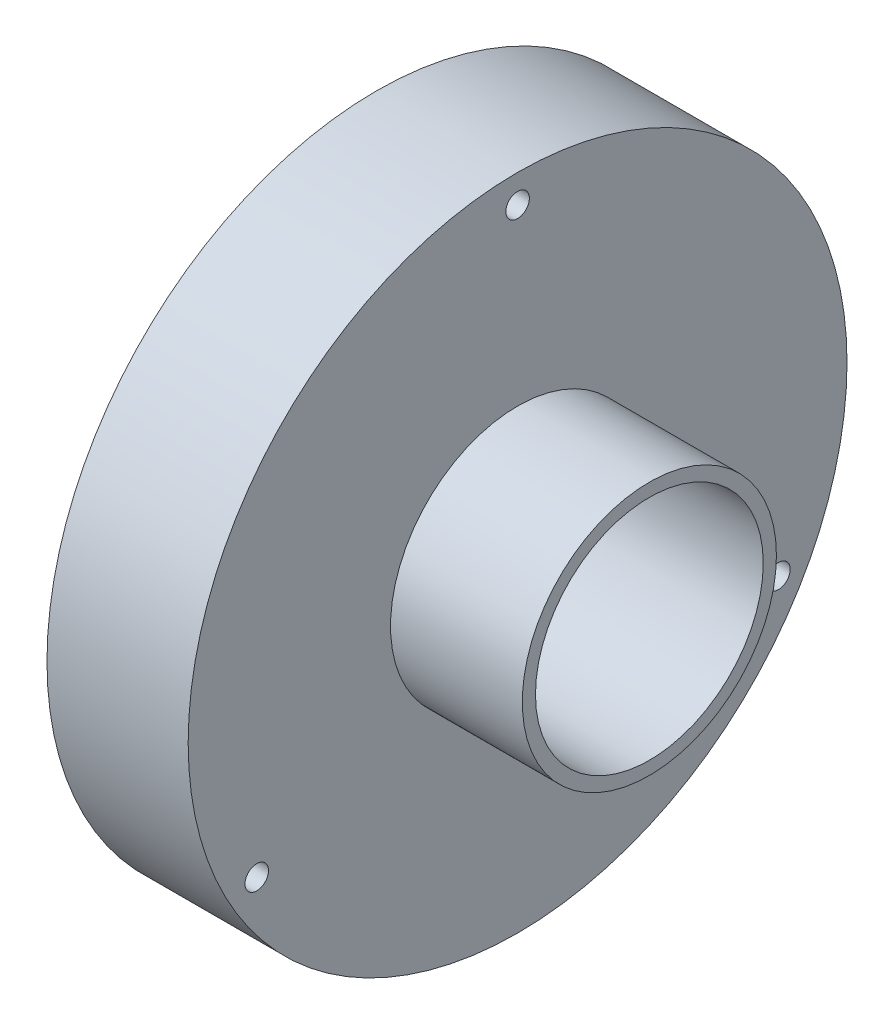
from build123d import *

# Parameters (mm, degrees)
BASPROSKE_W         = 5
BASPROSKE_H         = 4.25
TOOTHCUT_DEPTH      = 26.248762346
TEETHCUTS_COUNT     = 55
TEETHCUTS_ANGLE     = 353.454545455
BOSS_EXTRUDE1_START = 2.5
SKETCH1_R           = 17.5
SKETCH1_R_2         = 5.25
BOSS_EXTRUDE1_DEPTH = 2.5
SKETCH2_R           = 7.75
SKETCH2_R_2         = 5.25
BOSS_EXTRUDE2_DEPTH = 2.5
SKETCH3_R           = 6.05
CUT_EXTRUDE1_DEPTH  = 3.5
M1_6_TAPPED_HOLE1_D = 1.25
CIRPATTERN1_COUNT   = 3
SKETCH7_R           = 6.75
BOSS_EXTRUDE3_DEPTH = 7
SKETCH8_R           = 6.05
CUT_EXTRUDE2_DEPTH  = 7


with BuildPart() as part:
    # BasProSke → Base-Revolve (revolve)
    with BuildSketch(Plane(origin=(0, 0, 0), x_dir=(1, 0, 0), z_dir=(0, 1, 0)), mode=Mode.PRIVATE) as base_revolve_sk:
        with Locations((2.5, 15.375)):
            Rectangle(BASPROSKE_W, BASPROSKE_H)
    revolve(base_revolve_sk.sketch.rotate(Axis((-10, 0, 0), (1, 0, 0)), 180), axis=Axis((-10, 0, 0), (1, 0, 0)))

    # TooCutSke → ToothCut (cut, through all)
    with BuildSketch(Plane(origin=(0, 0, 0), x_dir=(0, 0, -1), z_dir=(1, 0, 0))):
        with BuildLine():
            ThreePointArc((0.61765291, 13.210168434), (0.417066145, 13.802967889), (0.163405078, 14.375071297))
            ThreePointArc((0.163405078, 14.375071297), (0, 14.376), (-0.163405078, 14.375071297))
            ThreePointArc((-0.163405078, 14.375071297), (-0.417066145, 13.802967889), (-0.61765291, 13.210168434))
            ThreePointArc((-0.61765291, 13.210168434), (0, 13.2246), (0.61765291, 13.210168434))
        make_face()
    toothcut = extrude(amount=TOOTHCUT_DEPTH, mode=Mode.SUBTRACT)

    # TeethCuts: ToothCut ×55 about axis
    teethcuts_axis = Axis((-10, 0, 0), (1, 0, 0))
    for i in range(1, TEETHCUTS_COUNT):
        add(toothcut.rotate(teethcuts_axis, i * TEETHCUTS_ANGLE / (TEETHCUTS_COUNT - 1)), mode=Mode.SUBTRACT)

    # Sketch1 → Boss-Extrude1 (add)
    with BuildSketch(Plane(origin=(5, 0, 0), x_dir=(0, 0, -1), z_dir=(1, 0, 0)).offset(BOSS_EXTRUDE1_START)):
        with Locations(Location((0, 0, 0), (0, 0, 180))):
            Circle(SKETCH1_R)
        Circle(SKETCH1_R_2, mode=Mode.SUBTRACT)
    extrude(amount=-BOSS_EXTRUDE1_DEPTH)

    # Sketch2 → Boss-Extrude2 (add)
    with BuildSketch(Plane.ZY.offset(-5)):
        with Locations(Location((0, 0, 0), (0, 0, 180))):
            Circle(SKETCH2_R)
        Circle(SKETCH2_R_2, mode=Mode.SUBTRACT)
    extrude(amount=BOSS_EXTRUDE2_DEPTH)

    # Sketch3 → Cut-Extrude1 (cut)
    with BuildSketch(Plane(origin=(7.5, 0, 0), x_dir=(0, 0, -1), z_dir=(1, 0, 0))):
        Circle(SKETCH3_R)
    extrude(amount=-CUT_EXTRUDE1_DEPTH, mode=Mode.SUBTRACT)

    # M1.6 Tapped Hole1 (through all)
    with Locations(Plane(origin=(7.5, 0, 0), x_dir=(0, 0, -1), z_dir=(1, 0, 0))):
        with Locations((0, 16)):
            m1_6_tapped_hole1 = Hole(M1_6_TAPPED_HOLE1_D / 2)

    # CirPattern1: M1.6 Tapped Hole1 ×3 about axis
    cirpattern1_axis = Axis((0, 0, 0), (1, 0, 0))
    for i in range(1, CIRPATTERN1_COUNT):
        add(m1_6_tapped_hole1.rotate(cirpattern1_axis, i * 360 / CIRPATTERN1_COUNT), mode=Mode.SUBTRACT)

    # Sketch7 → Boss-Extrude3 (add)
    with BuildSketch(Plane(origin=(7.5, 0, 0), x_dir=(0, 0, -1), z_dir=(1, 0, 0))):
        Circle(SKETCH7_R)
    extrude(amount=BOSS_EXTRUDE3_DEPTH)

    # Sketch8 → Cut-Extrude2 (cut)
    with BuildSketch(Plane(origin=(14.5, 0, 0), x_dir=(0, 0, -1), z_dir=(1, 0, 0))):
        Circle(SKETCH8_R)
    extrude(amount=-CUT_EXTRUDE2_DEPTH, mode=Mode.SUBTRACT)


solid = part.part
